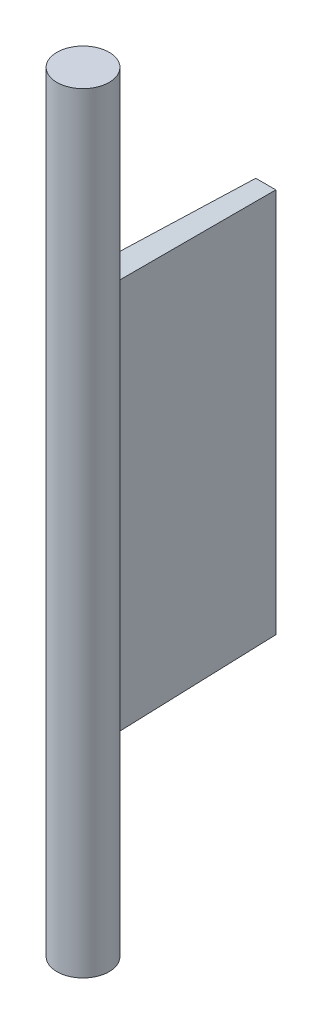
from build123d import *

# Parameters (mm, degrees)
SKIZZE2_R                       = 10
AUFSATZ_LINEAR_AUSTRAGEN1_DEPTH = 295
SKIZZE7_W                       = 10.134043554
SKIZZE7_H                       = 150
AUFSATZ_LINEAR_AUSTRAGEN2_DEPTH = 70
AUFSATZ_LINEAR_AUSTRAGEN2_DRAFT = -1


with BuildPart() as part:
    # Skizze2 → Aufsatz-Linear austragen1 (new body)
    with BuildSketch(Plane(origin=(0, 0, 0), x_dir=(1, 0, 0), z_dir=(0, 1, 0))):
        with Locations(Location((0, 0, 0), (0, 0, 270))):
            Circle(SKIZZE2_R)
    extrude(amount=AUFSATZ_LINEAR_AUSTRAGEN1_DEPTH)


with BuildPart() as aufsatz_linear_austragen2_tool:
    # Skizze7 → Aufsatz-Linear austragen2 (with draft: the straight prism first)
    with BuildSketch(Plane.XY):
        with Locations((0, 147.5)):
            Rectangle(SKIZZE7_W, SKIZZE7_H)
    extrude(amount=-AUFSATZ_LINEAR_AUSTRAGEN2_DEPTH)
    # Aufsatz-Linear austragen2: the draft: its side faces are tilted about the plane it starts from
    aufsatz_linear_austragen2_sides = [aufsatz_linear_austragen2_tool.faces().sort_by_distance(p)[0] for p in [
        (0, 222.5, -35),
        (-5.067021777, 147.5, -35),
        (0, 72.5, -35),
        (5.067021777, 147.5, -35),
    ]]
    draft(aufsatz_linear_austragen2_sides, Plane.XY, AUFSATZ_LINEAR_AUSTRAGEN2_DRAFT)


with BuildPart() as part_1:
    add(part.part)

    # Aufsatz-Linear austragen2: add aufsatz_linear_austragen2_tool
    add(aufsatz_linear_austragen2_tool.part)


solid = part_1.part
